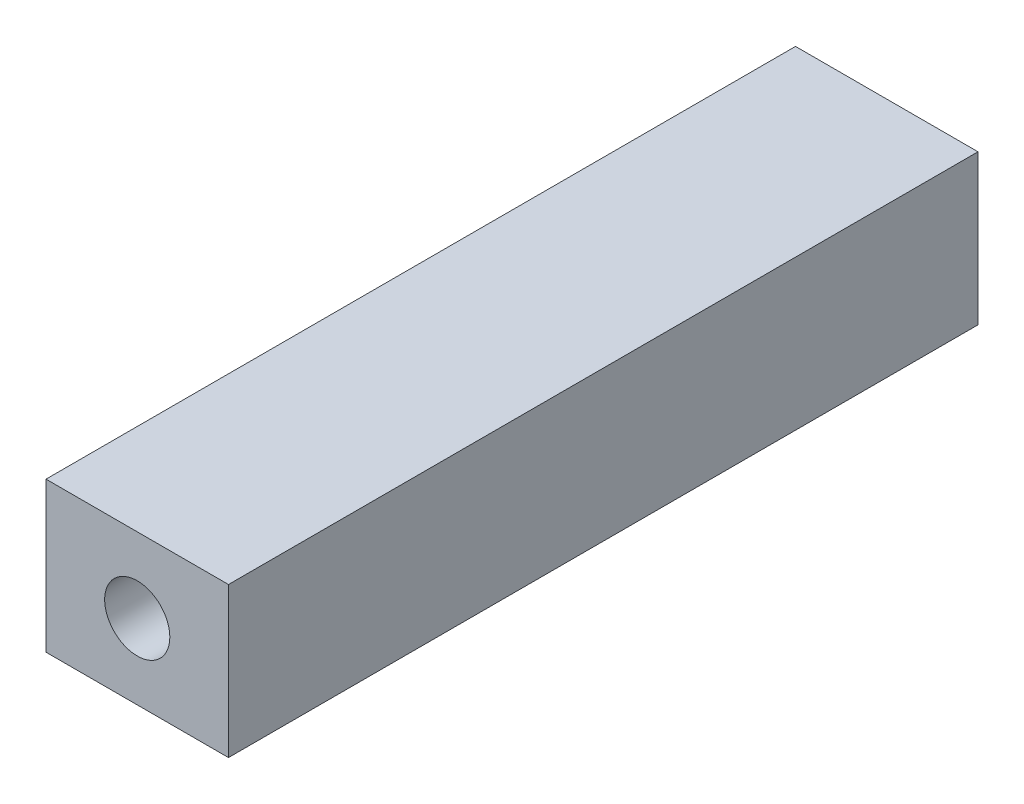
from build123d import *

# Parameters (mm, degrees)
SKETCH1_W           = 28
SKETCH1_H           = 23
SKETCH1_R           = 5
BOSS_EXTRUDE1_DEPTH = 57.5


with BuildPart() as part:
    # Sketch1 → Boss-Extrude1 (new, symmetric)
    with BuildSketch(Plane.XY):
        Rectangle(SKETCH1_W, SKETCH1_H)
        Circle(SKETCH1_R, mode=Mode.SUBTRACT)
    extrude(amount=BOSS_EXTRUDE1_DEPTH, both=True)


solid = part.part
